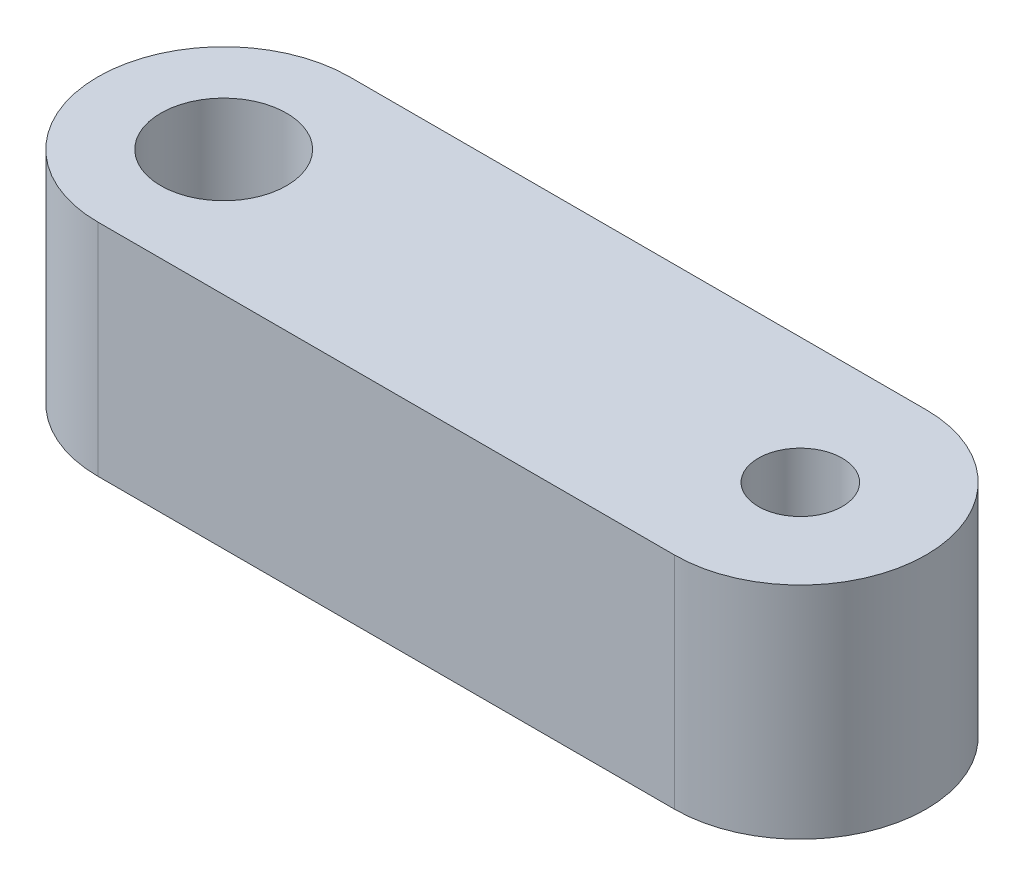
from build123d import *

# Parameters (mm, degrees)
EXTRUDE_1_DEPTH     = 5.25
CUT_EXTRUDE_1_REACH = 19.808
SKETCH_2_R          = 1.5
SKETCH_2_R_2        = 1


with BuildPart() as part:
    # 草图1 → 凸台-拉伸1 (new body)
    with BuildSketch(Plane(origin=(0, 0, 0), x_dir=(1, 0, 0), z_dir=(0, 1, 0))):
        with BuildLine():
            Line((0, 3), (13.75, 3))
            ThreePointArc((13.75, 3), (16.75, 0), (13.75, -3))
            Line((13.75, -3), (0, -3))
            ThreePointArc((0, -3), (-3, 0), (0, 3))
        make_face()
    extrude(amount=EXTRUDE_1_DEPTH)

    # 草图2 → 切除-拉伸1 (cut, up to next)
    with BuildSketch(Plane(origin=(0, 5.25, 0), x_dir=(1, 0, 0), z_dir=(0, 1, 0)), mode=Mode.PRIVATE) as cut_extrude_1_sk1:
        with Locations(Location((0, 0, 0), (0, 0, 270))):
            Circle(SKETCH_2_R)
    cut_extrude_1_tool1 = extrude(cut_extrude_1_sk1.sketch, amount=-CUT_EXTRUDE_1_REACH, mode=Mode.PRIVATE) & part.part
    # 草图2 → 切除-拉伸1 (cut, up to next)
    with BuildSketch(Plane(origin=(0, 5.25, 0), x_dir=(1, 0, 0), z_dir=(0, 1, 0)), mode=Mode.PRIVATE) as cut_extrude_1_sk2:
        with Locations(Location((13.75, 0, 0), (0, 0, 270))):
            Circle(SKETCH_2_R_2)
    cut_extrude_1_tool2 = extrude(cut_extrude_1_sk2.sketch, amount=-CUT_EXTRUDE_1_REACH, mode=Mode.PRIVATE) & part.part
    add(cut_extrude_1_tool1.solids().sort_by_distance((0, 5.25, 0))[0], mode=Mode.SUBTRACT)
    add(cut_extrude_1_tool2.solids().sort_by_distance((13.75, 5.25, 0))[0], mode=Mode.SUBTRACT)


solid = part.part
